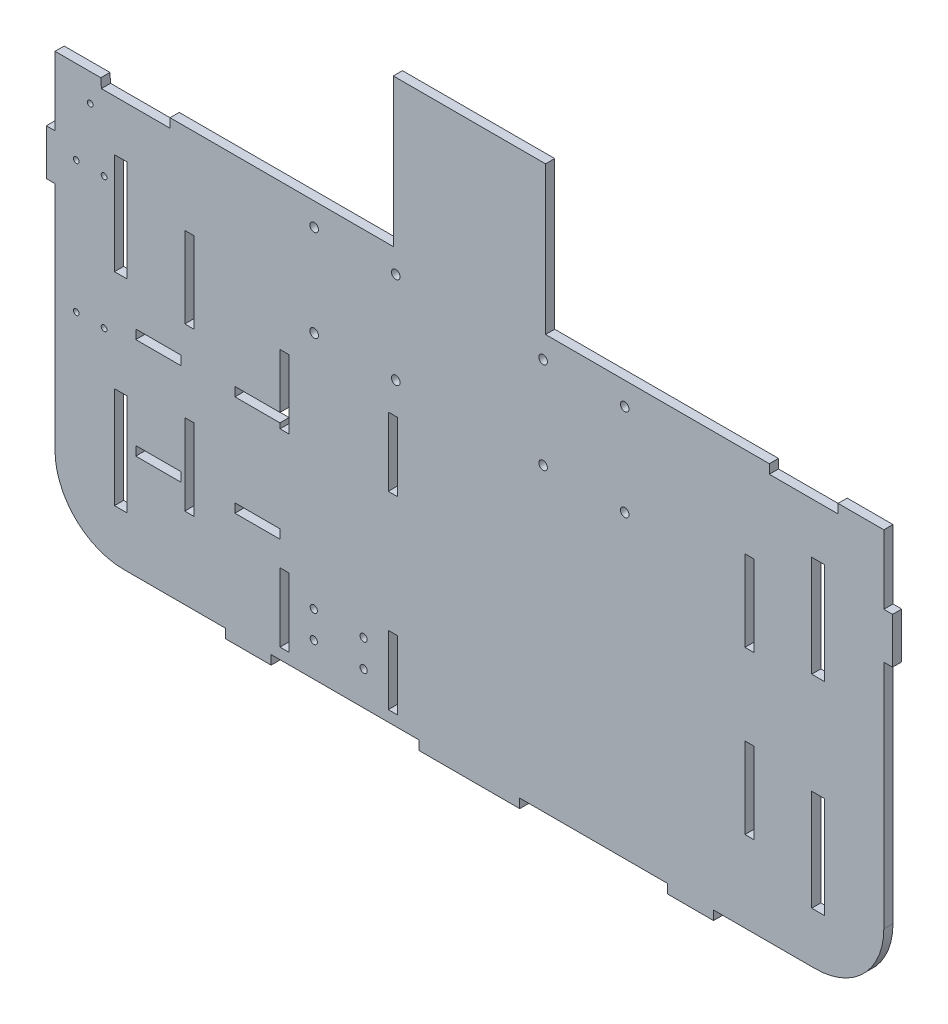
from build123d import *

# Parameters (mm, degrees)
SKETCH2_W           = 10.16
SKETCH2_H           = 76.2
SKETCH2_W_2         = 50
SKETCH2_H_2         = 10.16
SKETCH2_H_3         = 89.916
SKETCH2_R           = 3.175
SKETCH2_H_4         = 10
SKETCH2_R_2         = 4.7625
BOSS_EXTRUDE1_DEPTH = 10.16
SKETCH6_W           = 14
SKETCH6_H           = 112.399749
CUT_EXTRUDE1_DEPTH  = 15.24
CUT_EXTRUDE2_START  = -10.16
SKETCH11_R          = 4
CUT_EXTRUDE2_DEPTH  = 10.16


with BuildPart() as part:
    # Sketch2 → Boss-Extrude1 (new body)
    with BuildSketch(Plane.XY):
        with BuildLine():
            Line((-408.300796745, 142.616356263), (-408.921789204, 152.75736057))
            Line((-408.921789204, 152.75736057), (-459.721789204, 152.75736057))
            Line((-459.721789204, 152.75736057), (-459.721789204, 76.39736057))
            Line((-459.721789204, 76.39736057), (-469.435656714, 76.39736057))
            Line((-469.435656714, 76.39736057), (-469.435656714, 25.59736057))
            Line((-469.435656714, 25.59736057), (-459.721789204, 25.59736057))
            Line((-459.721789204, 25.59736057), (-459.721789204, -230.782639429))
            ThreePointArc((-459.721789204, -230.782639429), (-437.403325931, -284.664176156), (-383.521789204, -306.982639429))
            Line((-383.521789204, -306.982639429), (-303.52, -306.982639429))
            Line((-303.52, -306.982639429), (-270.8, -306.98263943))
            Line((-270.8, -306.98263943), (-270.8, -317.14263943))
            Line((-270.8, -317.14263943), (-220, -317.14263943))
            Line((-220, -317.14263943), (-220, -306.98263943))
            Line((-220, -306.98263943), (-55.8292, -306.982639429))
            Line((-55.8292, -306.982639429), (-55.8292, -317.14263943))
            Line((-55.8292, -317.14263943), (55.8292, -317.14263943))
            Line((55.8292, -317.14263943), (55.8292, -306.982639429))
            Line((55.8292, -306.982639429), (220, -306.98263943))
            Line((220, -306.98263943), (220, -317.14263943))
            Line((220, -317.14263943), (270.8, -317.14263943))
            Line((270.8, -317.14263943), (270.8, -306.98263943))
            Line((270.8, -306.98263943), (303.52, -306.982639429))
            Line((303.52, -306.982639429), (383.521789204, -306.982639429))
            ThreePointArc((383.521789204, -306.982639429), (437.403325931, -284.664176156), (459.721789204, -230.782639429))
            Line((459.721789204, -230.782639429), (459.721789204, 25.59736057))
            Line((459.721789204, 25.59736057), (469.435656714, 25.59736057))
            Line((469.435656714, 25.59736057), (469.435656714, 76.39736057))
            Line((469.435656714, 76.39736057), (459.721789204, 76.39736057))
            Line((459.721789204, 76.39736057), (459.721789204, 152.75736057))
            Line((459.721789204, 152.75736057), (408.921789204, 152.75736057))
            Line((408.921789204, 152.75736057), (408.921789204, 142.616356263))
            Line((408.921789204, 142.616356263), (332.721789204, 142.616356263))
            Line((332.721789204, 142.616356263), (332.721789204, 152.75736057))
            Line((332.721789204, 152.75736057), (84.450547773, 152.75736057))
            Line((84.450547773, 152.75736057), (84.450547773, 316.728644457))
            Line((84.450547773, 316.728644457), (-84.450547773, 316.728644457))
            Line((-84.450547773, 316.728644457), (-84.450547773, 152.75736057))
            Line((-84.450547773, 152.75736057), (-332.100796745, 152.75736057))
            Line((-332.100796745, 152.75736057), (-332.100796745, 142.616356263))
            Line((-332.100796745, 142.616356263), (-408.300796745, 142.616356263))
        make_face()
        with Locations((-205.08, -256.782661115)):
            Rectangle(SKETCH2_W, SKETCH2_H, mode=Mode.SUBTRACT)
        with Locations((-84.92, -256.782661115)):
            Rectangle(SKETCH2_W, SKETCH2_H, mode=Mode.SUBTRACT)
        with Locations((-345.16, -186.334154613)):
            Rectangle(SKETCH2_W_2, SKETCH2_H_2, mode=Mode.SUBTRACT)
        with Locations((-310.712287657, -172.10863943)):
            Rectangle(SKETCH2_W, SKETCH2_H_3, mode=Mode.SUBTRACT)
        with Locations((-436.123522935, -86.033983844)):
            Circle(SKETCH2_R, mode=Mode.SUBTRACT)
        with Locations((-405.323522935, -86.033983844)):
            Circle(SKETCH2_R, mode=Mode.SUBTRACT)
        with Locations((-235.16, -186.254154613)):
            Rectangle(SKETCH2_W_2, SKETCH2_H_4, mode=Mode.SUBTRACT)
        with Locations((310.712287657, -172.10863943)):
            Rectangle(SKETCH2_W, SKETCH2_H_3, mode=Mode.SUBTRACT)
        with Locations((-345.16, -74.366988355)):
            Rectangle(SKETCH2_W_2, SKETCH2_H_2, mode=Mode.SUBTRACT)
        with Locations((-310.712287657, 7.72336057)):
            Rectangle(SKETCH2_W, SKETCH2_H_3, mode=Mode.SUBTRACT)
        Polygon((-210.16, -79.446988355), (-260.16, -79.446988355), (-260.16, -69.446988355), (-210.16, -69.446988355), (-210.16, -8.96237531), (-200, -8.96237531), (-200, -85.16237531), (-210.16, -85.16237531), align=None, mode=Mode.SUBTRACT)
        with Locations((-84.92, -47.06237531)):
            Rectangle(SKETCH2_W, SKETCH2_H, mode=Mode.SUBTRACT)
        with Locations((-436.123522935, 60.016016156)):
            Circle(SKETCH2_R, mode=Mode.SUBTRACT)
        with Locations((-405.323522935, 60.016016156)):
            Circle(SKETCH2_R, mode=Mode.SUBTRACT)
        with Locations((-420.723522935, 122.038203417)):
            Circle(SKETCH2_R, mode=Mode.SUBTRACT)
        with Locations((-172.2755, 25.75736057)):
            Circle(SKETCH2_R_2, mode=Mode.SUBTRACT)
        with Locations((-81.7245, 25.75736057)):
            Circle(SKETCH2_R_2, mode=Mode.SUBTRACT)
        with Locations((-172.2755, 127.35736057)):
            Circle(SKETCH2_R_2, mode=Mode.SUBTRACT)
        with Locations((-81.7245, 127.35736057)):
            Circle(SKETCH2_R_2, mode=Mode.SUBTRACT)
        with Locations((310.712287657, 7.72336057)):
            Rectangle(SKETCH2_W, SKETCH2_H_3, mode=Mode.SUBTRACT)
        with Locations((81.7245, 25.75736057)):
            Circle(SKETCH2_R_2, mode=Mode.SUBTRACT)
        with Locations((81.7245, 127.35736057)):
            Circle(SKETCH2_R_2, mode=Mode.SUBTRACT)
        with Locations((172.2755, 25.75736057)):
            Circle(SKETCH2_R_2, mode=Mode.SUBTRACT)
        with Locations((172.2755, 127.35736057)):
            Circle(SKETCH2_R_2, mode=Mode.SUBTRACT)
    extrude(amount=-BOSS_EXTRUDE1_DEPTH)

    # Sketch6 → Cut-Extrude1 (cut)
    with BuildSketch(Plane(origin=(0, 0, -10.16), x_dir=(-1, 0, 0), z_dir=(0, 0, -1))):
        with Locations((386.721789204, 30.216607763)):
            Rectangle(SKETCH6_W, SKETCH6_H)
        with Locations((386.721789204, -194.582890237)):
            Rectangle(SKETCH6_W, SKETCH6_H)
    cut_extrude1 = extrude(amount=-CUT_EXTRUDE1_DEPTH, mode=Mode.SUBTRACT)

    # Mirror1: Cut-Extrude1 across plane
    add(cut_extrude1.mirror(Plane(origin=(0, 0, 0), x_dir=(0, 0, 1), z_dir=(1, 0, 0))), mode=Mode.SUBTRACT)

    # Sketch11 → Cut-Extrude2 (cut)
    with BuildSketch(Plane.XY.offset(CUT_EXTRUDE2_START)):
        with Locations((-172.6526, -269.442639029)):
            Circle(SKETCH11_R)
        with BuildLine():
            Line((-168.652969828, -239.497030969), (-176.652230173, -239.497030969))
            ThreePointArc((-176.652230173, -239.497030969), (-172.6526, -243.442639029), (-168.652969828, -239.497030969))
        make_face()
        with BuildLine():
            ThreePointArc((-168.6526, -239.442639029), (-172.679796599, -235.442731487), (-176.652230173, -239.497030969))
            Line((-176.652230173, -239.497030969), (-168.652969828, -239.497030969))
            ThreePointArc((-168.652969828, -239.497030969), (-168.652692458, -239.469835628), (-168.6526, -239.442639029))
        make_face()
        with BuildLine():
            ThreePointArc((-113.3474, -239.442639029), (-117.374596599, -235.442731487), (-121.347030173, -239.497030969))
            Line((-121.347030173, -239.497030969), (-113.347769828, -239.497030969))
            ThreePointArc((-113.347769828, -239.497030969), (-113.347492458, -239.469835628), (-113.3474, -239.442639029))
        make_face()
        with BuildLine():
            Line((-113.347769828, -239.497030969), (-121.347030173, -239.497030969))
            ThreePointArc((-121.347030173, -239.497030969), (-117.3474, -243.442639029), (-113.347769828, -239.497030969))
        make_face()
        with Locations((-117.3474, -269.442639029)):
            Circle(SKETCH11_R)
    extrude(amount=CUT_EXTRUDE2_DEPTH, mode=Mode.SUBTRACT)


solid = part.part
